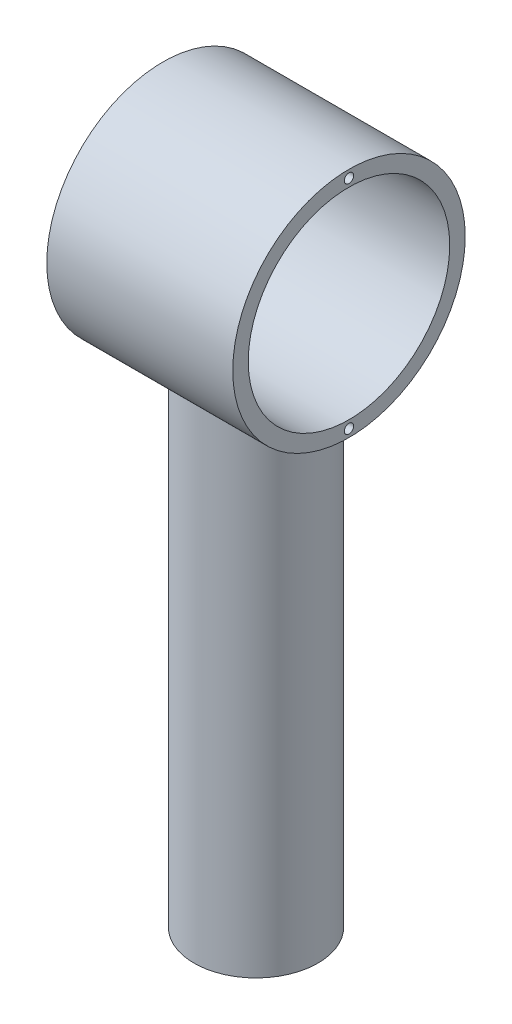
from build123d import *

# Parameters (mm, degrees)
SKETCH1_R                 = 20
BOSS_EXTRUDE1_DEPTH       = 25
BOSS_EXTRUDE2_START       = 100
SKETCH2_R                 = 20
BOSS_EXTRUDE2_DEPTH       = 100
BOSS_EXTRUDE4_START       = -100
SKETCH6_R                 = 20
BOSS_EXTRUDE4_DEPTH       = 100
SKETCH7_R                 = 25
CUT_EXTRUDE2_DEPTH        = 40
SKETCH8_R                 = 25
SKETCH8_R_2               = 22.5
BOSS_EXTRUDE7_DEPTH       = 40
SKETCH9_R                 = 25
BOSS_EXTRUDE8_DEPTH       = 2
BOSS_EXTRUDE10_DEPTH      = 38
CUT_EXTRUDE3_DEPTH        = 25
SKETCH12_R                = 25
CUT_EXTRUDE4_DEPTH        = 75
BOSS_EXTRUDE11_START      = 50
SKETCH14_R                = 20
BOSS_EXTRUDE11_DEPTH      = 50
BOSS_EXTRUDE12_DEPTH      = 10
BOSS_EXTRUDE12_DEPTH_BACK = 50
SKETCH13_R                = 37.5
SKETCH17_R                = 32.5
CUT_EXTRUDE5_DEPTH        = 50
BOSS_EXTRUDE13_START      = 2
SKETCH18_R                = 37.5
SKETCH18_R_2              = 32.5
BOSS_EXTRUDE13_DEPTH      = 2
SKETCH21_R                = 37.5
SKETCH21_R_2              = 32.5
CUT_EXTRUDE6_DEPTH        = 2
SKETCH22_R                = 1.5
CUT_EXTRUDE7_DEPTH        = 10


with BuildPart() as part:
    # Sketch1 → Boss-Extrude1 (new body)
    with BuildSketch(Plane(origin=(0, 0, 0), x_dir=(1, 0, 0), z_dir=(0, 1, 0))):
        with Locations(Location((0, 0, 0), (0, 0, 270))):
            Circle(SKETCH1_R)
        Polygon((14.43375673, 0), (7.216878365, 12.5), (-7.216878365, 12.5), (-14.43375673, 0), (-7.216878365, -12.5), (7.216878365, -12.5), align=None, mode=Mode.SUBTRACT)
    extrude(amount=BOSS_EXTRUDE1_DEPTH)

    # Sketch2 → Boss-Extrude2 (add)
    with BuildSketch(Plane.XZ.offset(BOSS_EXTRUDE2_START)):
        with Locations(Location((0, 0, 0), (0, 0, 270))):
            Circle(SKETCH2_R)
    extrude(amount=-BOSS_EXTRUDE2_DEPTH)

    # Sketch6 → Boss-Extrude4 (add)
    with BuildSketch(Plane(origin=(0, 25, 0), x_dir=(1, 0, 0), z_dir=(0, 1, 0)).offset(BOSS_EXTRUDE4_START)):
        with Locations(Location((0, 0, 0), (0, 0, 90))):
            Circle(SKETCH6_R)
    extrude(amount=BOSS_EXTRUDE4_DEPTH)

    # Sketch7 → Cut-Extrude2 (cut)
    with BuildSketch(Plane(origin=(20, 0, 0), x_dir=(0, 0, -1), z_dir=(1, 0, 0))):
        with Locations((0, 39.286563349)):
            Circle(SKETCH7_R)
    extrude(amount=-CUT_EXTRUDE2_DEPTH, mode=Mode.SUBTRACT)

    # Sketch8 → Boss-Extrude7 (add)
    with BuildSketch(Plane(origin=(20, 0, 0), x_dir=(0, 0, -1), z_dir=(1, 0, 0))):
        with Locations((0, 39.252781264)):
            Circle(SKETCH8_R)
        with Locations((0, 39.252781264)):
            Circle(SKETCH8_R_2, mode=Mode.SUBTRACT)
    extrude(amount=-BOSS_EXTRUDE7_DEPTH)

    # Sketch9 → Boss-Extrude8 (add)
    with BuildSketch(Plane(origin=(20, 0, 0), x_dir=(0, 0, -1), z_dir=(1, 0, 0))):
        with Locations((0, 39.252781264)):
            Circle(SKETCH9_R)
    extrude(amount=-BOSS_EXTRUDE8_DEPTH)

    # Sketch10 → Boss-Extrude10 (add)
    with BuildSketch(Plane.ZY.offset(-18)):
        with BuildLine():
            Line((-15.081099266, 22.555163323), (15.081099266, 22.555163323))
            ThreePointArc((15.081099266, 22.555163323), (0, 16.752781264), (-15.081099266, 22.555163323))
        make_face()
    extrude(amount=BOSS_EXTRUDE10_DEPTH)

    # Sketch11 → Cut-Extrude3 (cut)
    with BuildSketch(Plane.XZ.offset(100)):
        Polygon((12.5, 7.216878365), (0, 14.43375673), (0, 0), (12.5, 0), align=None)
        Polygon((0, 0), (0, 14.43375673), (-12.5, 7.216878365), (-12.5, -7.216878365), (0, -14.43375673), (12.5, -7.216878365), (12.5, 0), align=None)
    extrude(amount=-CUT_EXTRUDE3_DEPTH, mode=Mode.SUBTRACT)

    # Sketch12 → Cut-Extrude4 (cut)
    with BuildSketch(Plane(origin=(20, 0, 0), x_dir=(0, 0, -1), z_dir=(1, 0, 0))):
        with Locations((0, 39.252781264)):
            Circle(SKETCH12_R)
    extrude(amount=-CUT_EXTRUDE4_DEPTH, mode=Mode.SUBTRACT)

    # Sketch14 → Boss-Extrude11 (add)
    with BuildSketch(Plane.XZ.offset(100).offset(BOSS_EXTRUDE11_START)):
        with Locations(Location((0, 0, 0), (0, 0, 270))):
            Circle(SKETCH14_R)
        Polygon((0, -14.43375673), (12.5, -7.216878365), (12.5, 7.216878365), (0, 14.43375673), (-12.5, 7.216878365), (-12.5, -7.216878365), align=None, mode=Mode.SUBTRACT)
    extrude(amount=-BOSS_EXTRUDE11_DEPTH)

    # Sketch13 → Boss-Extrude12 (add, two sides: drawn at the far end of the back side and taken through both)
    with BuildSketch(Plane(origin=(20, 0, 0), x_dir=(0, 0, -1), z_dir=(1, 0, 0)).offset(-BOSS_EXTRUDE12_DEPTH_BACK)):
        with Locations((0, 39.33472939)):
            Circle(SKETCH13_R)
    extrude(amount=BOSS_EXTRUDE12_DEPTH + BOSS_EXTRUDE12_DEPTH_BACK)

    # Sketch17 → Cut-Extrude5 (cut)
    with BuildSketch(Plane(origin=(30, 0, 0), x_dir=(0, 0, -1), z_dir=(1, 0, 0))):
        with Locations((0, 39.33472939)):
            Circle(SKETCH17_R)
    extrude(amount=-CUT_EXTRUDE5_DEPTH, mode=Mode.SUBTRACT)

    # Sketch18 → Boss-Extrude13 (add)
    with BuildSketch(Plane(origin=(30, 0, 0), x_dir=(0, 0, -1), z_dir=(1, 0, 0)).offset(BOSS_EXTRUDE13_START)):
        with Locations((0, 39.33472939)):
            Circle(SKETCH18_R)
        with Locations((0, 39.33472939)):
            Circle(SKETCH18_R_2, mode=Mode.SUBTRACT)
    extrude(amount=-BOSS_EXTRUDE13_DEPTH)

    # Sketch21 → Cut-Extrude6 (cut)
    with BuildSketch(Plane(origin=(32, 0, 0), x_dir=(0, 0, -1), z_dir=(1, 0, 0))):
        with Locations((0, 39.33472939)):
            Circle(SKETCH21_R)
        with Locations((0, 39.33472939)):
            Circle(SKETCH21_R_2, mode=Mode.SUBTRACT)
    extrude(amount=-CUT_EXTRUDE6_DEPTH, mode=Mode.SUBTRACT)

    # Sketch22 → Cut-Extrude7 (cut)
    with BuildSketch(Plane(origin=(30, 0, 0), x_dir=(0, 0, -1), z_dir=(1, 0, 0))):
        with Locations((0, 74.33472939)):
            Circle(SKETCH22_R)
        with Locations((0, 4.33472939)):
            Circle(SKETCH22_R)
    extrude(amount=-CUT_EXTRUDE7_DEPTH, mode=Mode.SUBTRACT)


solid = part.part
